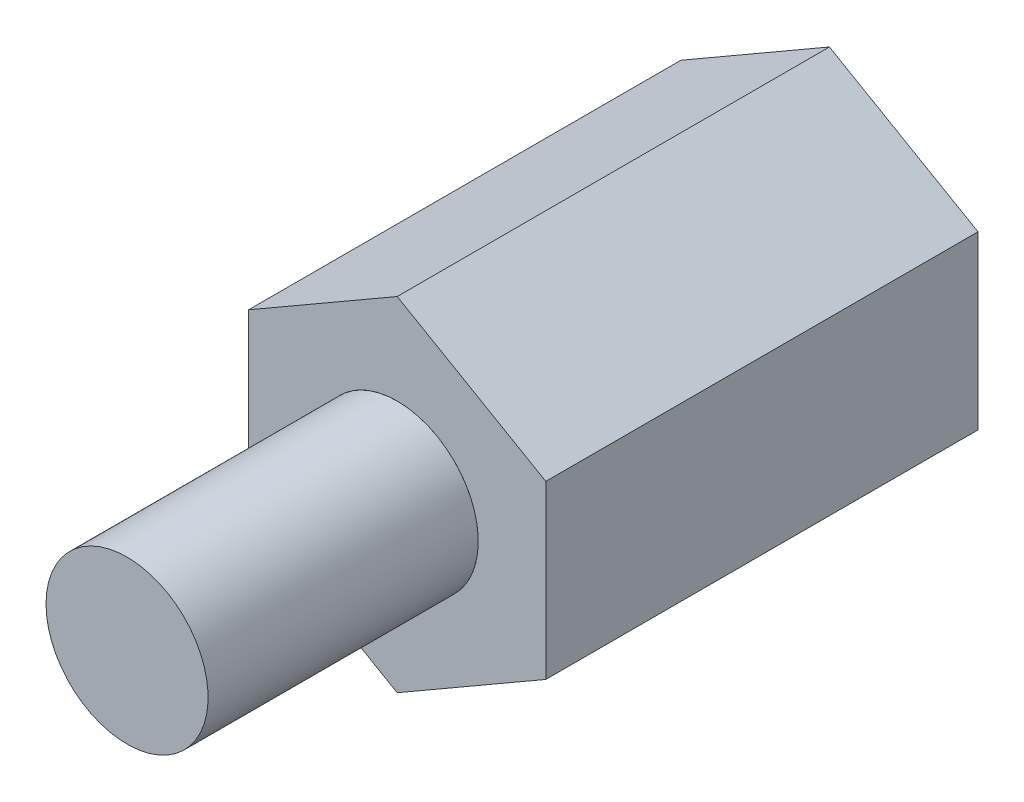
from build123d import *

# Parameters (mm, degrees)
SKETCH_1_R      = 1.5
EXTRUDE_1_DEPTH = 8
SKETCH_2_R      = 1.5
EXTRUDE_2_DEPTH = 5


with BuildPart() as part:
    # Эскиз1 → Бобышка-Вытянуть1 (new body)
    with BuildSketch(Plane.XY):
        Polygon((2.75, 1.58771324), (0, 3.175426481), (-2.75, 1.58771324), (-2.75, -1.58771324), (0, -3.175426481), (2.75, -1.58771324), align=None)
        Circle(SKETCH_1_R, mode=Mode.SUBTRACT)
    extrude(amount=EXTRUDE_1_DEPTH)


with BuildPart() as body_2:
    # Эскиз2 → Бобышка-Вытянуть2 (new body)
    with BuildSketch(Plane(origin=(0, 0, 8), x_dir=(-1, 0, 0), z_dir=(0, 0, -1))):
        Circle(SKETCH_2_R)
    extrude(amount=-EXTRUDE_2_DEPTH)


solid = Compound([part.part, body_2.part])
